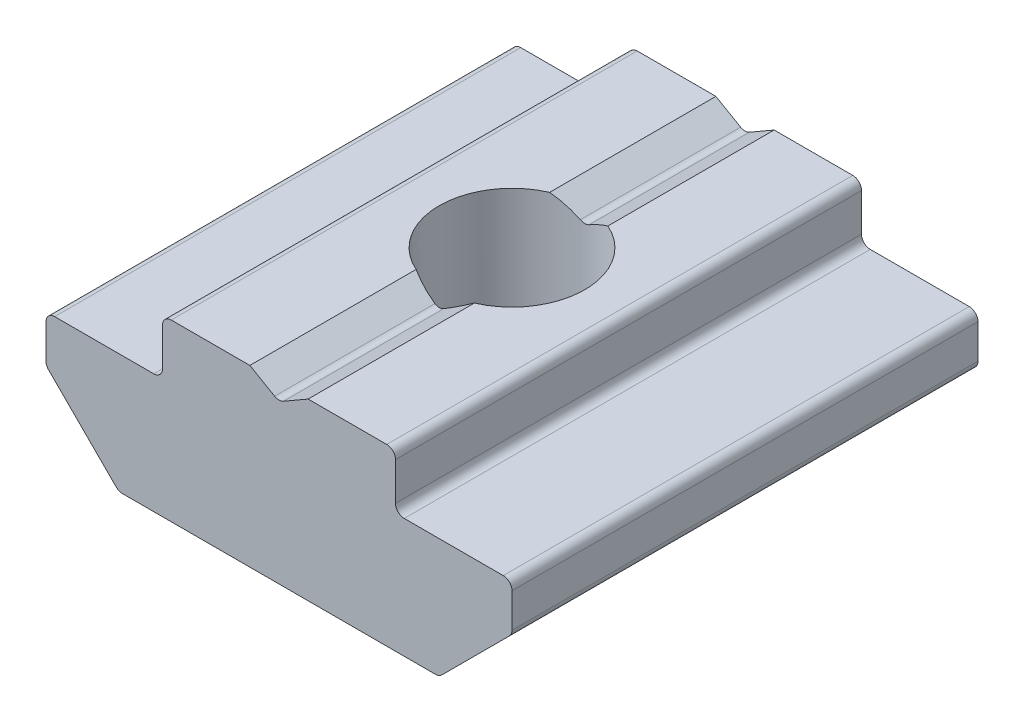
from build123d import *

# Parameters (mm, degrees)
EXTRUDE1_DEPTH     = 16
SKETCH2_R          = 2.5
CUT_EXTRUDE1_DEPTH = 19.867962423


with BuildPart() as part:
    # Sketch1 → Extrude1 (new body)
    with BuildSketch(Plane.XY):
        with BuildLine():
            add(Edge.make_bspline(
                [(-0.15, -0.490747729), (0, -0.577350269), (0.15, -0.490747729)],
                knots=[3.665191429, 3.665191429, 3.665191429, 4.71238898, 4.71238898, 4.71238898], degree=2, weights=[1, 0.866025404, 1]))
            Line((-0.15, -0.490747729), (-1, 0))
            Line((-1, 0), (-3.7, 0))
            add(Edge.make_bspline(
                [(-3.7, 0), (-4, 0), (-4, -0.3)],
                knots=[3.141592654, 3.141592654, 3.141592654, 4.71238898, 4.71238898, 4.71238898], degree=2, weights=[1, 0.707106781, 1]))
            Line((-4, -0.3), (-4, -1.6))
            add(Edge.make_bspline(
                [(-4.3, -1.9), (-4, -1.9), (-4, -1.6)],
                knots=[4.71238898, 4.71238898, 4.71238898, 6.283185307, 6.283185307, 6.283185307], degree=2, weights=[1, 0.707106781, 1]))
            Line((-4.3, -1.9), (-7.7, -1.9))
            add(Edge.make_bspline(
                [(-7.7, -1.9), (-8, -1.9), (-8, -2.2)],
                knots=[1.570796327, 1.570796327, 1.570796327, 3.141592654, 3.141592654, 3.141592654], degree=2, weights=[1, 0.707106781, 1]))
            Line((-8, -2.2), (-8, -3.375735931))
            add(Edge.make_bspline(
                [(-8, -3.375735931), (-8, -3.5), (-7.912132034, -3.587867966)],
                knots=[0, 0, 0, 0.785398163, 0.785398163, 0.785398163], degree=2, weights=[1, 0.923879533, 1]))
            Line((-7.912132034, -3.587867966), (-5.587867966, -5.912132034))
            add(Edge.make_bspline(
                [(-5.587867966, -5.912132034), (-5.5, -6), (-5.375735931, -6)],
                knots=[1.570796327, 1.570796327, 1.570796327, 2.35619449, 2.35619449, 2.35619449], degree=2, weights=[1, 0.923879533, 1]))
            Line((-5.375735931, -6), (-2.46, -6))
            Line((-2.46, -6), (2.46, -6))
            Line((2.46, -6), (5.375735931, -6))
            add(Edge.make_bspline(
                [(5.375735931, -6), (5.5, -6), (5.587867966, -5.912132034)],
                knots=[1.570796327, 1.570796327, 1.570796327, 2.35619449, 2.35619449, 2.35619449], degree=2, weights=[1, 0.923879533, 1]))
            Line((5.587867966, -5.912132034), (7.912132034, -3.587867966))
            add(Edge.make_bspline(
                [(7.912132034, -3.587867966), (8, -3.5), (8, -3.375735931)],
                knots=[1.570796327, 1.570796327, 1.570796327, 2.35619449, 2.35619449, 2.35619449], degree=2, weights=[1, 0.923879533, 1]))
            Line((8, -3.375735931), (8, -2.2))
            add(Edge.make_bspline(
                [(8, -2.2), (8, -1.9), (7.7, -1.9)],
                knots=[0, 0, 0, 1.570796327, 1.570796327, 1.570796327], degree=2, weights=[1, 0.707106781, 1]))
            Line((7.7, -1.9), (4.3, -1.9))
            add(Edge.make_bspline(
                [(4, -1.6), (4, -1.9), (4.3, -1.9)],
                knots=[1.570796327, 1.570796327, 1.570796327, 3.141592654, 3.141592654, 3.141592654], degree=2, weights=[1, 0.707106781, 1]))
            Line((4, -1.6), (4, -0.3))
            add(Edge.make_bspline(
                [(4, -0.3), (4, 0), (3.7, 0)],
                knots=[0, 0, 0, 1.570796327, 1.570796327, 1.570796327], degree=2, weights=[1, 0.707106781, 1]))
            Line((3.7, 0), (1, 0))
            Line((1, 0), (0.15, -0.490747729))
        make_face()
    extrude(amount=EXTRUDE1_DEPTH)

    # Sketch2 → Cut-Extrude1 (cut, through all)
    with BuildSketch(Plane(origin=(0, 0, 0), x_dir=(1, 0, 0), z_dir=(0, 1, 0))):
        with Locations(Location((0, -8, 0), (0, 0, 180))):
            Circle(SKETCH2_R)
    extrude(amount=-CUT_EXTRUDE1_DEPTH, mode=Mode.SUBTRACT)


solid = part.part
